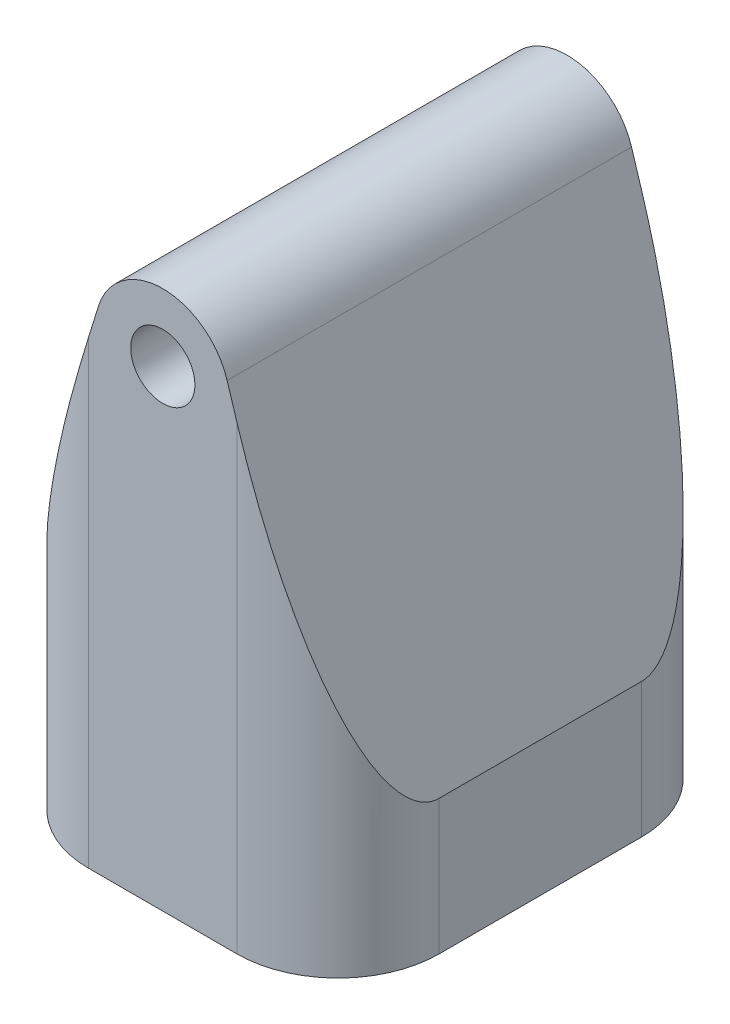
from build123d import *

# Parameters (mm, degrees)
SKETCH1_W           = 30
SKETCH1_H           = 40
BOSS_EXTRUDE1_DEPTH = 13
SKETCH2_R           = 2.38125
CUT_EXTRUDE1_DEPTH  = 39.327535793
SKETCH3_R           = 2.8067
CUT_EXTRUDE2_DEPTH  = 10
FILLET1_R           = 7.5


with BuildPart() as part:
    # Sketch1 → Boss-Extrude1 (new, symmetric)
    with BuildSketch(Plane(origin=(0, 0, 0), x_dir=(0, 0, -1), z_dir=(1, 0, 0))):
        Rectangle(SKETCH1_W, SKETCH1_H)
    extrude(amount=BOSS_EXTRUDE1_DEPTH, both=True)

    # Sketch2 → Cut-Extrude1 (cut, through all)
    with BuildSketch(Plane.XY.offset(15)):
        with BuildLine():
            Line((-13, 20), (-13, -10))
            Line((-13, -10), (-4.775007753, 16.483004032))
            ThreePointArc((-4.775007753, 16.483004032), (-2.965213301, 19.025855198), (0, 20))
            Line((0, 20), (-13, 20))
        make_face()
        with Locations((0, 15)):
            Circle(SKETCH2_R)
        with BuildLine():
            Line((13, 20), (0, 20))
            ThreePointArc((0, 20), (2.965213301, 19.025855198), (4.775007753, 16.483004032))
            Line((4.775007753, 16.483004032), (13, -10))
            Line((13, -10), (13, 20))
        make_face()
    extrude(amount=-CUT_EXTRUDE1_DEPTH, mode=Mode.SUBTRACT)

    # Sketch3 → Cut-Extrude2 (cut)
    with BuildSketch(Plane.XZ.offset(20)):
        with Locations(Location((0, 10, 0), (0, 0, 270))):
            Circle(SKETCH3_R)
        with Locations(Location((0, -10, 0), (0, 0, 270))):
            Circle(SKETCH3_R)
        with Locations(Location((-10, 0, 0), (0, 0, 270))):
            Circle(SKETCH3_R)
        with Locations(Location((10, 0, 0), (0, 0, 270))):
            Circle(SKETCH3_R)
    extrude(amount=-CUT_EXTRUDE2_DEPTH, mode=Mode.SUBTRACT)

    # Fillet1
    fillet1_edges = [part.edges().sort_by_distance(p)[0] for p in [
        (-13, -15, 15),
        (13, -15, 15),
        (13, -15, -15),
        (-13, -15, -15),
    ]]
    fillet(fillet1_edges, radius=FILLET1_R)


solid = part.part
